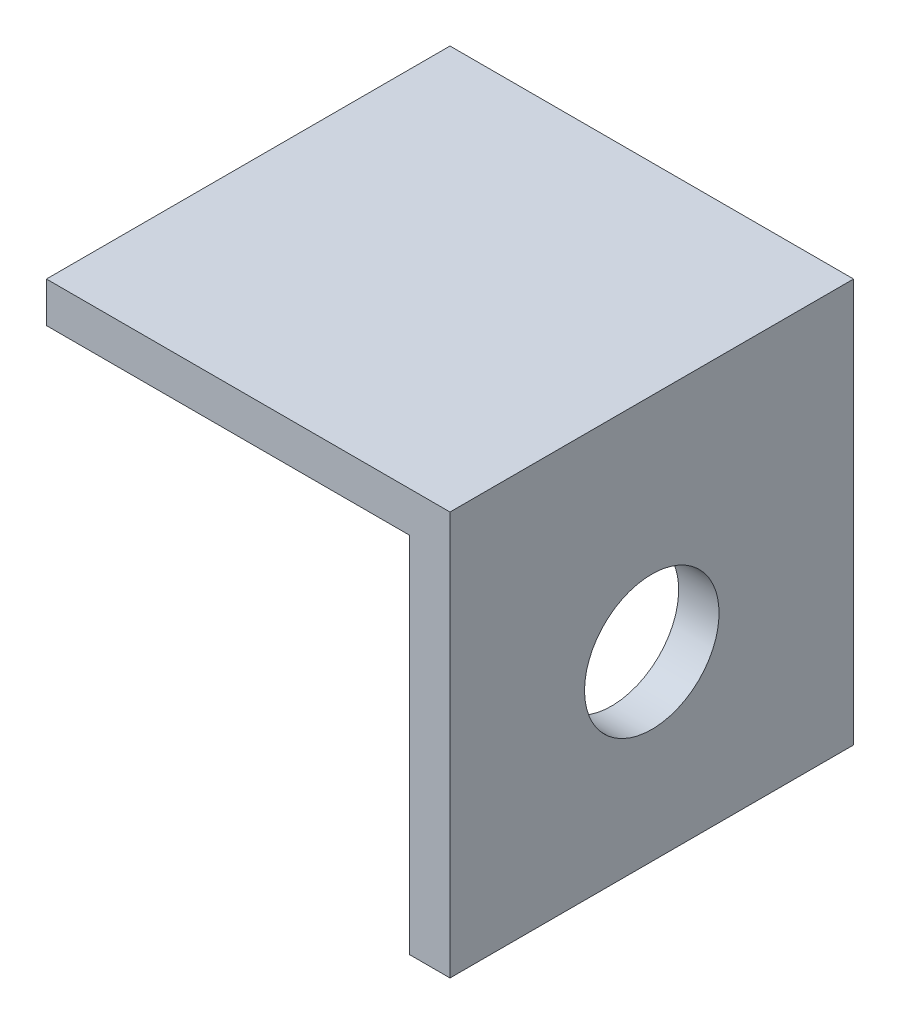
from build123d import *

# Parameters (mm, degrees)
BOSS_EXTRU_1_DEPTH = 30
D_GAGEMENT_M81_D   = 10
D_GAGEMENT_M82_D   = 10
D_GAGEMENT_M83_D   = 10
D_GAGEMENT_M84_D   = 10


with BuildPart() as part:
    # Esquisse1 → Boss.-Extru.1 (new body)
    with BuildSketch(Plane.XY):
        Polygon((0, 0), (0, -30), (-3, -30), (-3, -3), (-30, -3), (-30, 0), align=None)
    extrude(amount=-BOSS_EXTRU_1_DEPTH)

    # Dégagement M81 (through all)
    with Locations(Plane(origin=(-3, -21, 985), x_dir=(0, -1, 0), z_dir=(-1, 0, 0))):
        with Locations((-4.5, 1000), (-4.5, -1000)):
            Hole(D_GAGEMENT_M81_D / 2)

    # Dégagement M82 (through all)
    with Locations(Plane(origin=(33, -21, -1015), x_dir=(0, -1, 0), z_dir=(1, 0, 0))):
        with Locations((-4.5, 1000), (-4.5, -1000)):
            Hole(D_GAGEMENT_M82_D / 2)

    # Dégagement M83 (through all)
    with Locations(Plane(origin=(33, -21, 985), x_dir=(0, -1, 0), z_dir=(1, 0, 0))):
        with Locations((-4.5, 1000), (-4.5, -1000)):
            Hole(D_GAGEMENT_M83_D / 2)

    # Dégagement M84 (through all)
    with Locations(Plane(origin=(-3, -21, -1015), x_dir=(0, -1, 0), z_dir=(-1, 0, 0))):
        with Locations((-4.5, 1000), (-4.5, -1000)):
            Hole(D_GAGEMENT_M84_D / 2)


solid = part.part
